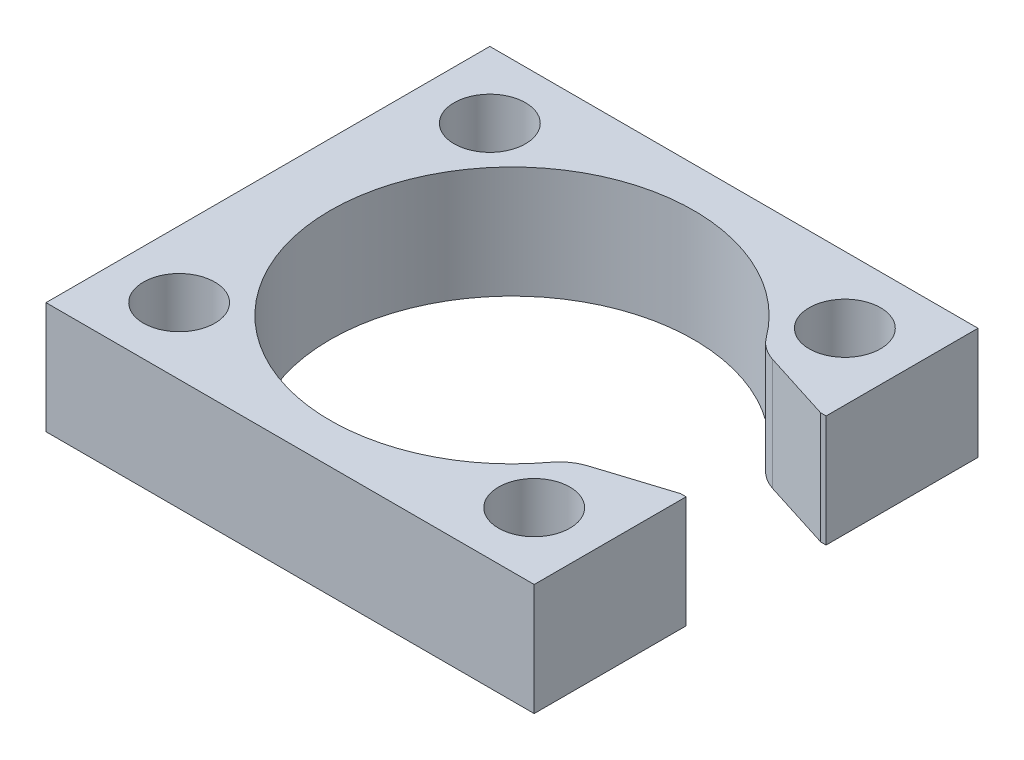
from build123d import *

# Parameters (mm, degrees)
SKETCH1_W              = 34.925
SKETCH1_H              = 31.75
PLATE_DEPTH            = 4
F_10_CLEARANCE_HOLE1_D = 5.1054
LOAD_CELL_CUTOUT_REACH = 26.919
FILLET1_R              = 3.175


with BuildPart() as part:
    # Sketch1 → Plate (new, symmetric)
    with BuildSketch(Plane(origin=(0, 0, 0), x_dir=(1, 0, 0), z_dir=(0, 1, 0))):
        Rectangle(SKETCH1_W, SKETCH1_H)
    extrude(amount=PLATE_DEPTH, both=True)

    # #10 Clearance Hole1 (through all)
    with Locations(Plane(origin=(0, 4, 0), x_dir=(1, 0, 0), z_dir=(0, 1, 0))):
        with Locations((-12.7, 11.1125), (12.7, 11.1125), (12.7, -11.1125), (-12.7, -11.1125)):
            Hole(F_10_CLEARANCE_HOLE1_D / 2)

    # Sketch4 → Load Cell Cutout (cut, up to next)
    with BuildSketch(Plane(origin=(0, 4, 0), x_dir=(1, 0, 0), z_dir=(0, 1, 0)), mode=Mode.PRIVATE) as load_cell_cutout_sk1:
        with BuildLine():
            Line((11.009869163, 6.927542495), (17.078427656, 5.008))
            Line((17.078427656, 5.008), (22.733, 5.008))
            Line((22.733, 5.008), (22.733, -5.008))
            Line((22.733, -5.008), (17.078427656, -5.008))
            Line((17.078427656, -5.008), (11.009869163, -6.927542495))
            ThreePointArc((11.009869163, -6.927542495), (-13.008, 0), (11.009869163, 6.927542495))
        make_face()
    load_cell_cutout_tool1 = extrude(load_cell_cutout_sk1.sketch, amount=-LOAD_CELL_CUTOUT_REACH, mode=Mode.PRIVATE) & part.part
    add(load_cell_cutout_tool1.solids().sort_by_distance((2.977457, 4, 0))[0], mode=Mode.SUBTRACT)

    # Fillet1
    fillet1_edges = [part.edges().sort_by_distance(p)[0] for p in [
        (11.009869163, 0, 6.927542495),
        (11.009869163, 0, -6.927542495),
    ]]
    fillet(fillet1_edges, radius=FILLET1_R)


solid = part.part
